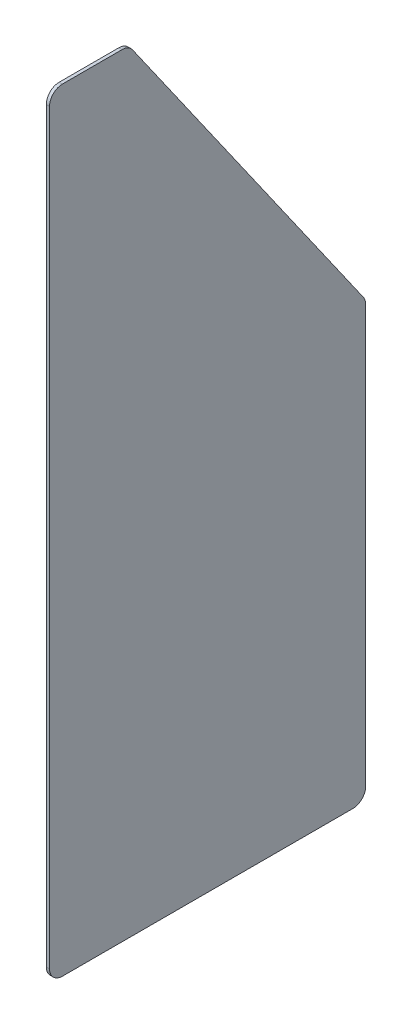
from build123d import *

# Parameters (mm, degrees)
SKETCH1_W           = 1.5875
SKETCH1_H           = 155.8925
BOSS_EXTRUDE1_DEPTH = 381
CUT_EXTRUDE1_DEPTH  = 1.5875
FILLET1_R           = 6.35


with BuildPart() as part:
    # Sketch1 → Boss-Extrude1 (new body)
    with BuildSketch(Plane(origin=(0, 0, 0), x_dir=(1, 0, 0), z_dir=(0, 1, 0))):
        with Locations((0.79375, 77.94625)):
            Rectangle(SKETCH1_W, SKETCH1_H)
    extrude(amount=BOSS_EXTRUDE1_DEPTH)

    # Sketch2 → Cut-Extrude1 (cut)
    with BuildSketch(Plane.ZY):
        Polygon((-39.0525, 381), (-155.8925, 214.122), (-155.8925, 381), align=None)
    extrude(amount=-CUT_EXTRUDE1_DEPTH, mode=Mode.SUBTRACT)

    # Fillet1
    fillet1_edges = [part.edges().sort_by_distance(p)[0] for p in [
        (0.79375, 381, -39.0525),
        (0.79375, 214.122, -155.8925),
        (0.79375, 381, 0),
        (0.79375, 0, -155.8925),
        (0.79375, 0, 0),
    ]]
    fillet(fillet1_edges, radius=FILLET1_R)


solid = part.part
